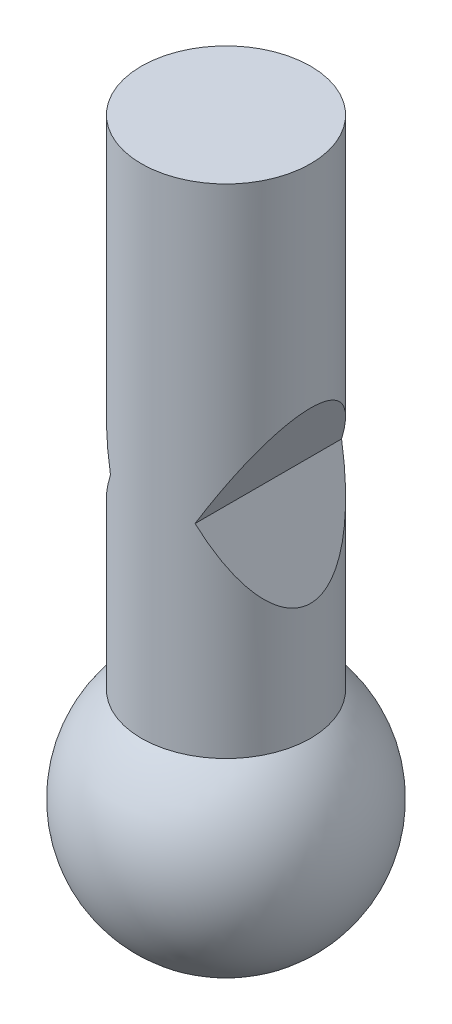
from build123d import *

# Parameters (mm, degrees)
SKETCH2_R               = 10
BOSS_EXTRUDE1_DEPTH     = 70
CUT_EXTRUDE1_DEPTH      = 74.143694192
CUT_EXTRUDE1_DEPTH_BACK = 74.143694192


with BuildPart() as part:
    # Sketch1 → Revolve1 (revolve)
    with BuildSketch(Plane.XY):
        with BuildLine():
            Line((0, 15), (0, -15))
            ThreePointArc((0, -15), (15, 0), (0, 15))
        make_face()
    revolve(axis=Axis((0, -733.142524484, 0), (0, 1, 0)))

    # Sketch2 → Boss-Extrude1 (add)
    with BuildSketch(Plane(origin=(0, 0, 0), x_dir=(1, 0, 0), z_dir=(0, 1, 0))):
        with Locations(Location((0, 0, 0), (0, 0, 90))):
            Circle(SKETCH2_R)
    extrude(amount=BOSS_EXTRUDE1_DEPTH)

    # Sketch3 → Cut-Extrude1 (cut, two sides: drawn at the far end of the back side and taken through both)
    with BuildSketch(Plane.XY.offset(-CUT_EXTRUDE1_DEPTH_BACK)):
        Polygon((10, 45), (5, 35), (10, 25), align=None)
        Polygon((-10, 45), (-10, 25), (-5, 35), align=None)
    extrude(amount=CUT_EXTRUDE1_DEPTH + CUT_EXTRUDE1_DEPTH_BACK, mode=Mode.SUBTRACT)


solid = part.part
